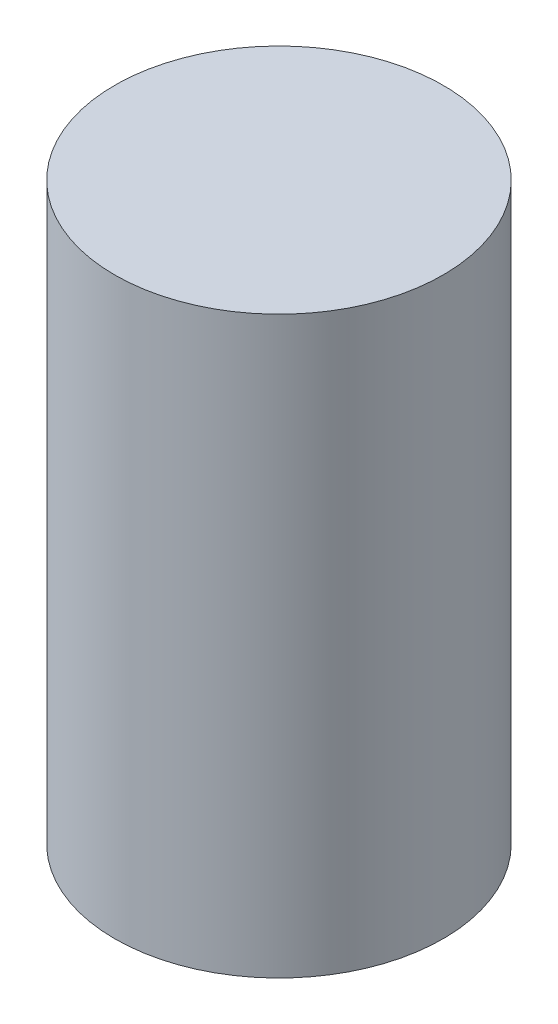
from build123d import *

# Parameters (mm, degrees)
SKETCH2_R           = 2
BOSS_EXTRUDE1_DEPTH = 7


with BuildPart() as part:
    # Sketch2 → Boss-Extrude1 (new body)
    with BuildSketch(Plane(origin=(0, 0, 0), x_dir=(1, 0, 0), z_dir=(0, 1, 0))):
        with Locations(Location((-33.755907466, 30.156932038, 0), (0, 0, 270))):
            Circle(SKETCH2_R)
    extrude(amount=BOSS_EXTRUDE1_DEPTH)


solid = part.part
